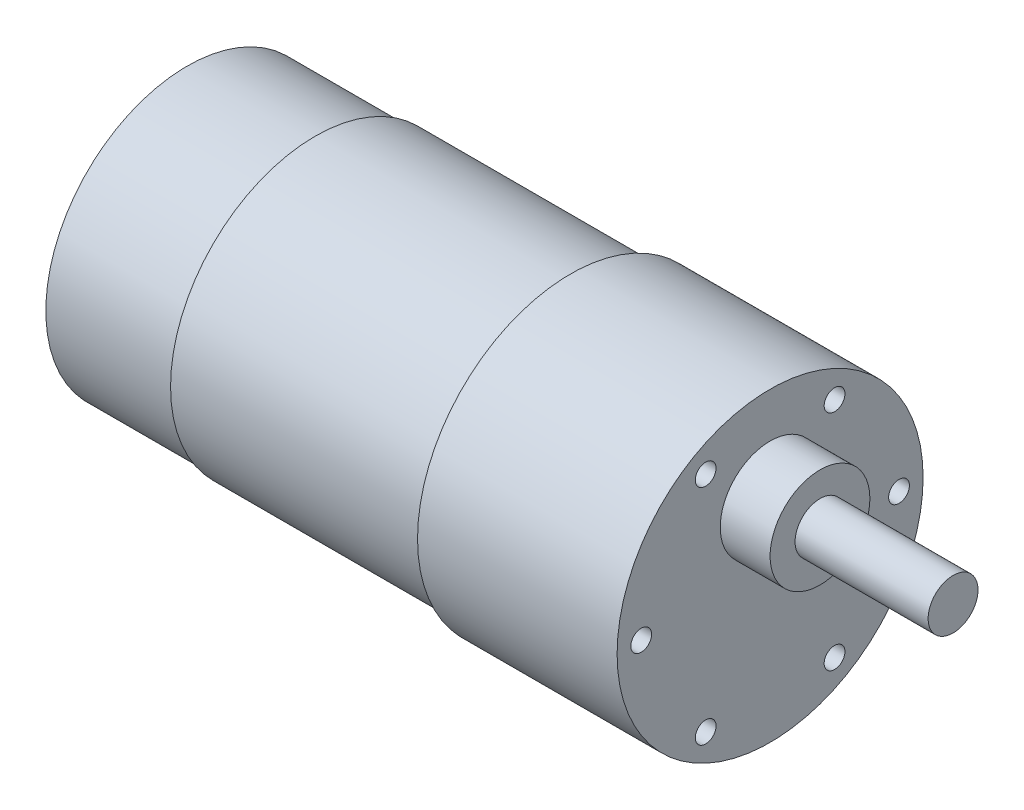
from build123d import *

# Parameters (mm, degrees)
SK_GEARBOX_R              = 18.4
EX_GEARBOX_DEPTH          = 24
SK_MOTOR_R                = 17.4
EX_MOTOR_DEPTH            = 30.7
SK_ENCODER_R              = 17
EX_ENCODER_DEPTH          = 15.4
SK_BUSHING_R              = 6
EX_BUSHING_DEPTH          = 6
SK_SHAFT_R                = 3
EX_SHAFT_DEPTH            = 16
SK_MOUNTHOLES_6XM3_R      = 1.25
CUT_MOUNTHOLES_6XM3_DEPTH = 3


with BuildPart() as part:
    # SK_Gearbox → EX_Gearbox (new body)
    with BuildSketch(Plane(origin=(0, 0, 0), x_dir=(0, 0, -1), z_dir=(1, 0, 0))):
        Circle(SK_GEARBOX_R)
    extrude(amount=-EX_GEARBOX_DEPTH)

    # SK_Motor → EX_Motor (add)
    with BuildSketch(Plane(origin=(-24, 0, 0), x_dir=(0, 0, -1), z_dir=(1, 0, 0))):
        Circle(SK_MOTOR_R)
    extrude(amount=-EX_MOTOR_DEPTH)

    # SK_Encoder → EX_Encoder (add)
    with BuildSketch(Plane(origin=(-54.7, 0, 0), x_dir=(0, 0, -1), z_dir=(1, 0, 0))):
        Circle(SK_ENCODER_R)
    extrude(amount=-EX_ENCODER_DEPTH)

    # SK_Bushing → EX_Bushing (add)
    with BuildSketch(Plane(origin=(0, 0, 0), x_dir=(0, 0, -1), z_dir=(1, 0, 0))):
        with Locations((0, 7)):
            Circle(SK_BUSHING_R)
    extrude(amount=EX_BUSHING_DEPTH)

    # SK_Shaft → EX_Shaft (add)
    with BuildSketch(Plane(origin=(6, 0, 0), x_dir=(0, 0, -1), z_dir=(1, 0, 0))):
        with Locations((0, 7)):
            Circle(SK_SHAFT_R)
    extrude(amount=EX_SHAFT_DEPTH)

    # SK_MountHoles_6xM3 → CUT_MountHoles_6xM3 (cut)
    with BuildSketch(Plane(origin=(0, 0, 0), x_dir=(0, 0, -1), z_dir=(1, 0, 0))):
        with Locations((-15.5, 0)):
            Circle(SK_MOUNTHOLES_6XM3_R)
        with Locations((-7.75, 13.423393759)):
            Circle(SK_MOUNTHOLES_6XM3_R)
        with Locations((7.75, 13.423393759)):
            Circle(SK_MOUNTHOLES_6XM3_R)
        with Locations((15.5, 0)):
            Circle(SK_MOUNTHOLES_6XM3_R)
        with Locations((7.75, -13.423393759)):
            Circle(SK_MOUNTHOLES_6XM3_R)
        with Locations((-7.75, -13.423393759)):
            Circle(SK_MOUNTHOLES_6XM3_R)
    extrude(amount=-CUT_MOUNTHOLES_6XM3_DEPTH, mode=Mode.SUBTRACT)


solid = part.part
